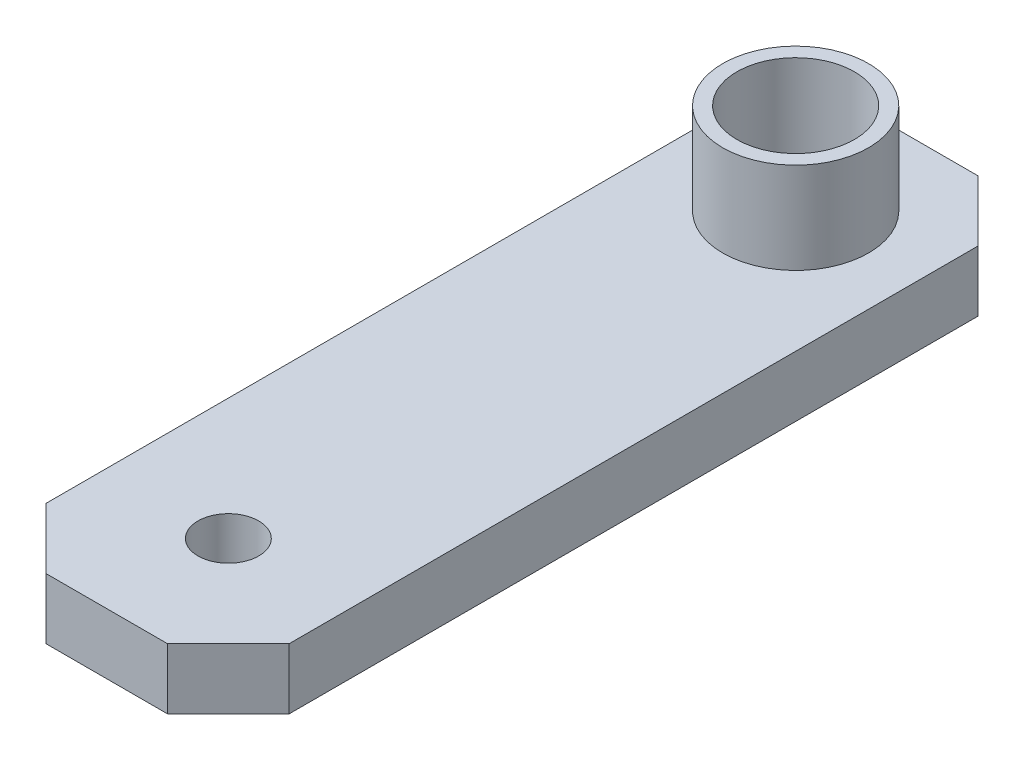
from build123d import *

# Parameters (mm, degrees)
SKETCH1_R           = 1.5
BOSS_EXTRUDE1_DEPTH = 3
SKETCH2_R           = 3.6
SKETCH2_R_2         = 2.9
BOSS_EXTRUDE2_DEPTH = 4.5


with BuildPart() as part:
    # Sketch1 → Boss-Extrude1 (new body)
    with BuildSketch(Plane(origin=(0, 0, 0), x_dir=(1, 0, 0), z_dir=(0, 1, 0))):
        Polygon((-6, 17), (-3, 20), (3, 20), (6, 17), (6, -17), (3, -20), (-3, -20), (-6, -17), align=None)
        with Locations(Location((0, 14, 0), (0, 0, 270))):
            Circle(SKETCH1_R, mode=Mode.SUBTRACT)
        with Locations(Location((0, -14, 0), (0, 0, 270))):
            Circle(SKETCH1_R, mode=Mode.SUBTRACT)
    extrude(amount=BOSS_EXTRUDE1_DEPTH)

    # Sketch2 → Boss-Extrude2 (add)
    with BuildSketch(Plane(origin=(0, 3, 0), x_dir=(1, 0, 0), z_dir=(0, 1, 0))):
        with Locations(Location((0, 14, 0), (0, 0, 270))):
            Circle(SKETCH2_R)
        with Locations(Location((0, 14, 0), (0, 0, 270))):
            Circle(SKETCH2_R_2, mode=Mode.SUBTRACT)
    extrude(amount=BOSS_EXTRUDE2_DEPTH)


solid = part.part
